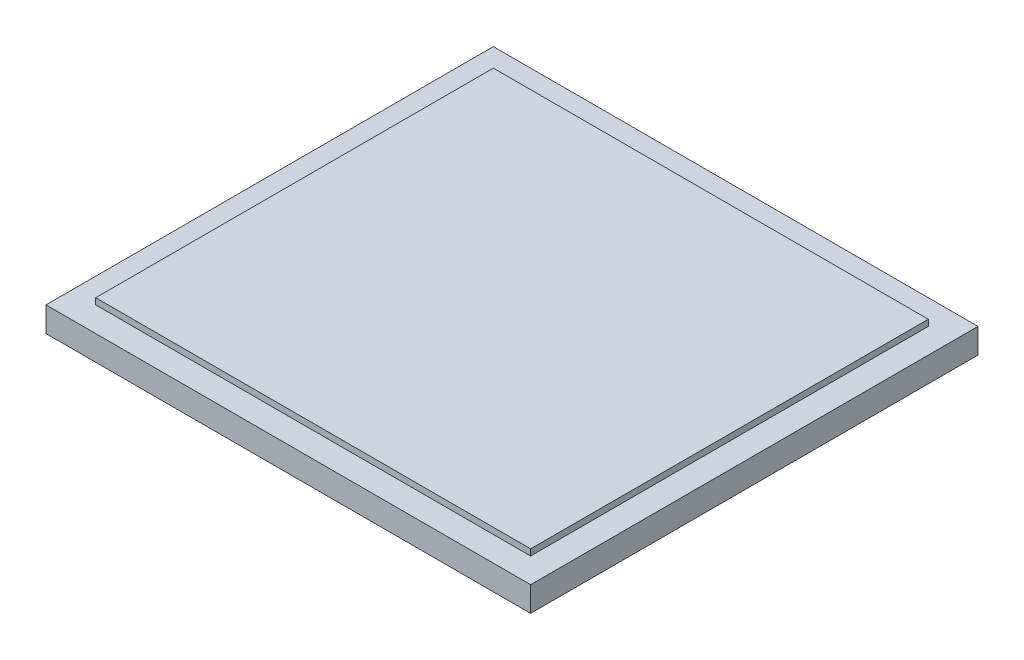
from build123d import *

# Parameters (mm, degrees)
SKETCH2_W           = 195
SKETCH2_H           = 180
BOSS_EXTRUDE1_DEPTH = 10
SKETCH3_W           = 175
SKETCH3_H           = 160
BOSS_EXTRUDE2_DEPTH = 2.5


with BuildPart() as part:
    # Sketch2 → Boss-Extrude1 (new body)
    with BuildSketch(Plane(origin=(0, 0, 0), x_dir=(1, 0, 0), z_dir=(0, 1, 0))):
        with Locations((97.5, 90)):
            Rectangle(SKETCH2_W, SKETCH2_H)
    extrude(amount=BOSS_EXTRUDE1_DEPTH)

    # Sketch3 → Boss-Extrude2 (add)
    with BuildSketch(Plane(origin=(0, 10, 0), x_dir=(1, 0, 0), z_dir=(0, 1, 0))):
        with Locations((97.5, 90)):
            Rectangle(SKETCH3_W, SKETCH3_H)
    extrude(amount=BOSS_EXTRUDE2_DEPTH)


solid = part.part
